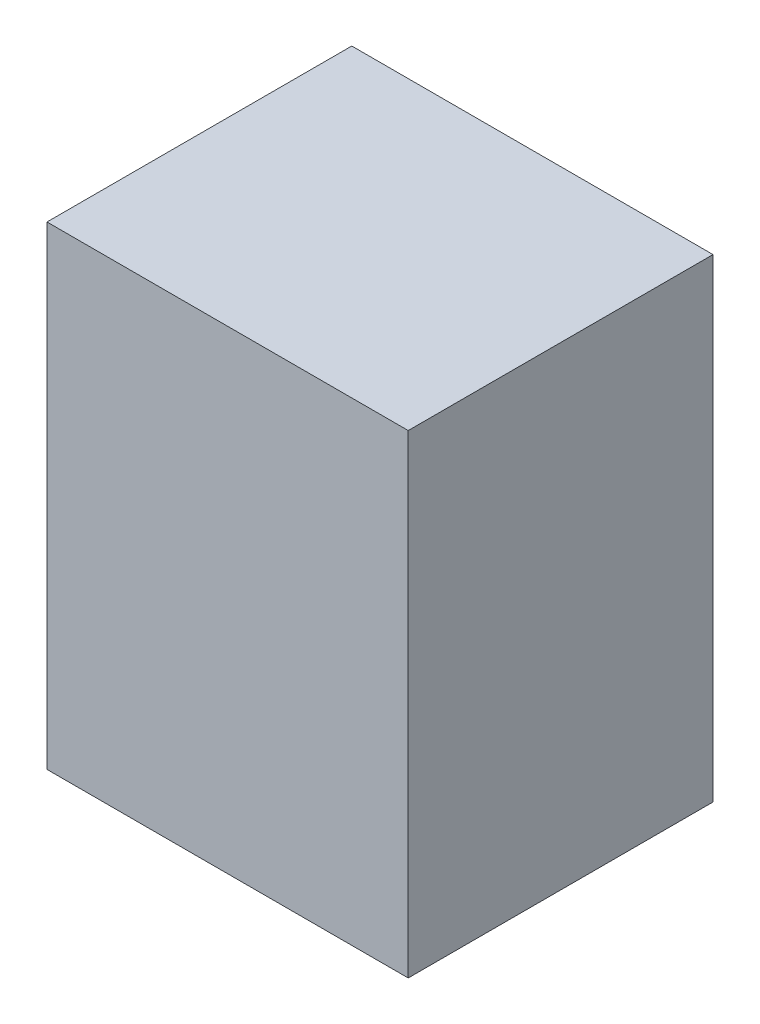
from build123d import *

# Parameters (mm, degrees)
SKETCH1_W           = 16
SKETCH1_H           = 21
BOSS_EXTRUDE1_DEPTH = 13.5


with BuildPart() as part:
    # Sketch1 → Boss-Extrude1 (new body)
    with BuildSketch(Plane.XY):
        with Locations((-26.1, -38.9)):
            Rectangle(SKETCH1_W, SKETCH1_H)
    extrude(amount=BOSS_EXTRUDE1_DEPTH)


solid = part.part
